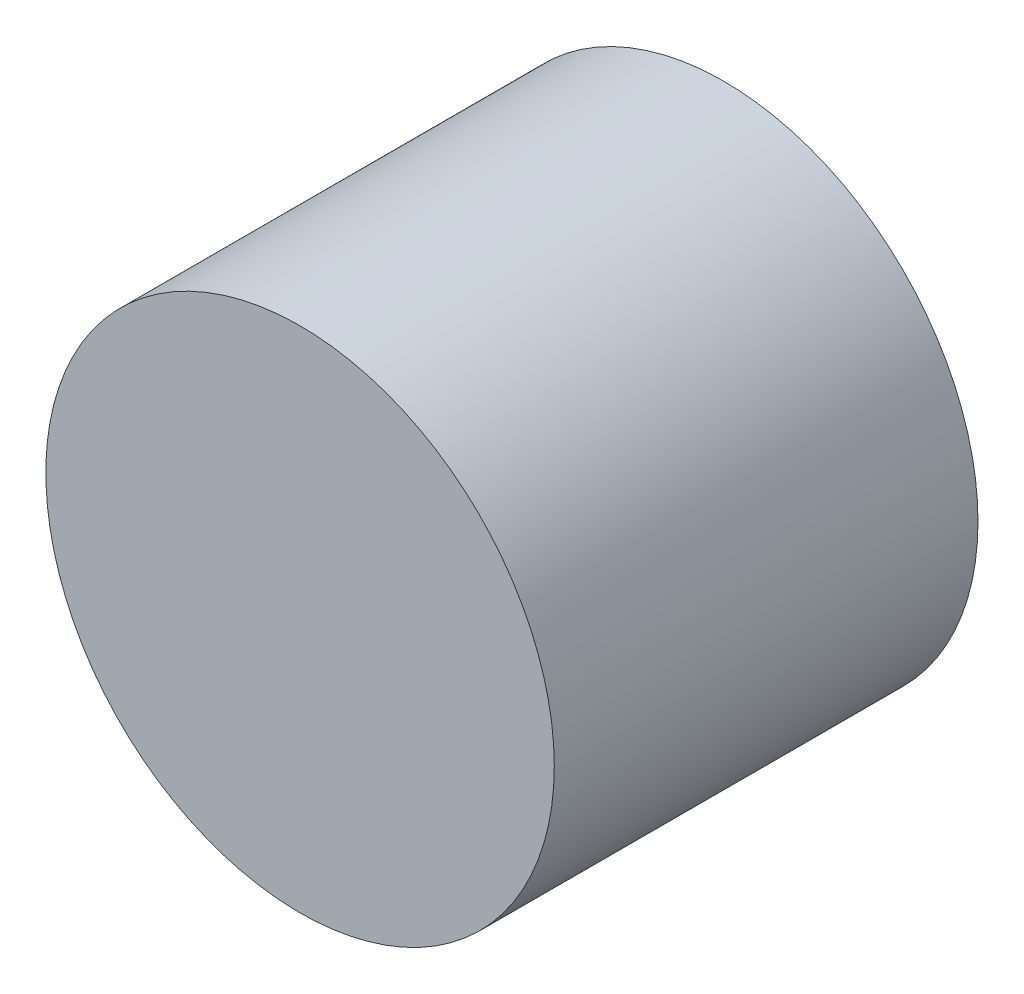
from build123d import *

# Parameters (mm, degrees)
SKETCH_1_R      = 30
EXTRUDE_1_DEPTH = 50


with BuildPart() as part:
    # Эскиз1 → Бобышка-Вытянуть1 (new body)
    with BuildSketch(Plane.XY):
        Circle(SKETCH_1_R)
    extrude(amount=EXTRUDE_1_DEPTH)


solid = part.part
